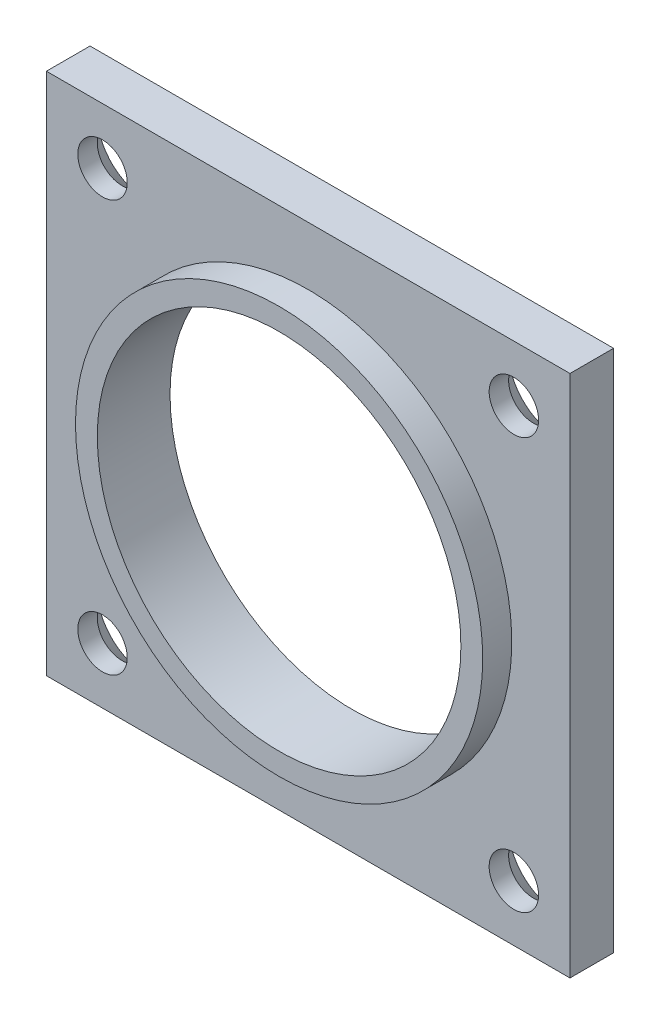
from build123d import *

# Parameters (mm, degrees)
ESBO_O1_W                            = 36
ESBO_O1_H                            = 36
ESBO_O1_R                            = 12.5
RESSALTO_EXTRUS_O1_DEPTH             = 3
ESBO_O2_R                            = 14
ESBO_O2_R_2                          = 12.5
RESSALTO_EXTRUS_O2_DEPTH             = 2
ESCAREADO_PARA_SFHCS_M32_D           = 3.4
ESCAREADO_PARA_SFHCS_M32_CSINK_D     = 6.72
ESCAREADO_PARA_SFHCS_M32_CSINK_ANGLE = 90


with BuildPart() as part:
    # Esboço1 → Ressalto-extrusão1 (new body)
    with BuildSketch(Plane.XY):
        Rectangle(ESBO_O1_W, ESBO_O1_H)
        Circle(ESBO_O1_R, mode=Mode.SUBTRACT)
    extrude(amount=RESSALTO_EXTRUS_O1_DEPTH)

    # Esboço2 → Ressalto-extrusão2 (add)
    with BuildSketch(Plane.XY.offset(3)):
        with Locations(Location((0, 0, 0), (0, 0, 180))):
            Circle(ESBO_O2_R)
        Circle(ESBO_O2_R_2, mode=Mode.SUBTRACT)
    extrude(amount=RESSALTO_EXTRUS_O2_DEPTH)

    # Escareado para SFHCS M32 (through all)
    with Locations(Plane(origin=(0, 0, 0), x_dir=(-1, 0, 0), z_dir=(0, 0, -1))):
        with Locations((-14.142135624, 14.142135624), (14.142135624, 14.142135624), (14.142135624, -14.142135624), (-14.142135624, -14.142135624)):
            CounterSinkHole(ESCAREADO_PARA_SFHCS_M32_D / 2, ESCAREADO_PARA_SFHCS_M32_CSINK_D / 2, counter_sink_angle=ESCAREADO_PARA_SFHCS_M32_CSINK_ANGLE)


solid = part.part
